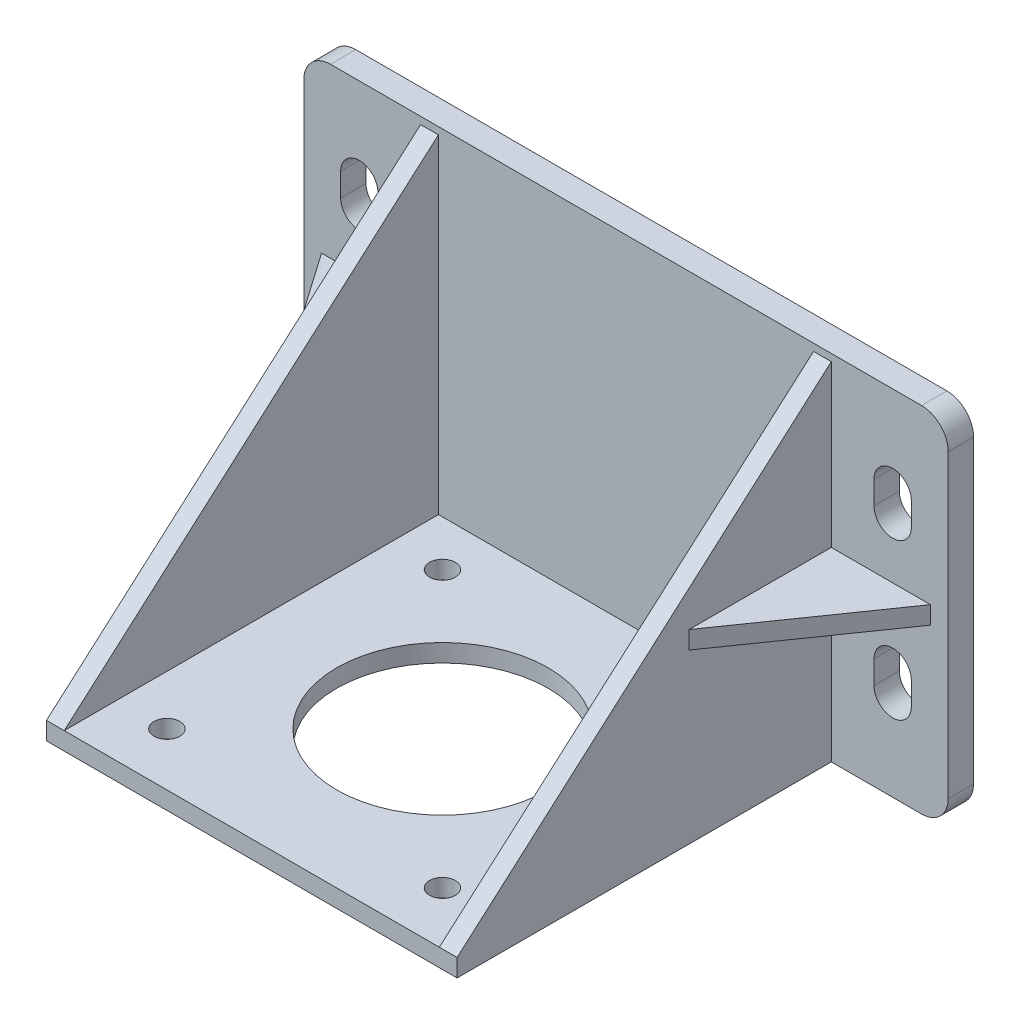
from build123d import *

# Parameters (mm, degrees)
SKETCH1_W           = 72.5
SKETCH1_H           = 39.8
BOSS_EXTRUDE1_DEPTH = 2.85
BOSS_EXTRUDE2_DEPTH = 23.1
SKETCH5_W           = 42.2
SKETCH5_H           = 42.1
CUT_EXTRUDE1_DEPTH  = 37.8
CUT_EXTRUDE2_REACH  = 71.017
SKETCH6_R           = 1.45
SKETCH6_R_2         = 11.9
FILLET1_R           = 3
BOSS_EXTRUDE3_DEPTH = 1


with BuildPart() as part:
    # Sketch1 → Boss-Extrude1 (new body)
    with BuildSketch(Plane.XY):
        Rectangle(SKETCH1_W, SKETCH1_H)
        with BuildLine():
            Line((-27.9, 10.05), (-27.9, 7.45))
            ThreePointArc((-27.9, 7.45), (-30, 5.35), (-32.1, 7.45))
            Line((-32.1, 7.45), (-32.1, 10.05))
            ThreePointArc((-32.1, 10.05), (-30, 12.15), (-27.9, 10.05))
        make_face(mode=Mode.SUBTRACT)
        with BuildLine():
            Line((-27.9, -10.05), (-27.9, -7.45))
            ThreePointArc((-27.9, -7.45), (-30, -5.35), (-32.1, -7.45))
            Line((-32.1, -7.45), (-32.1, -10.05))
            ThreePointArc((-32.1, -10.05), (-30, -12.15), (-27.9, -10.05))
        make_face(mode=Mode.SUBTRACT)
        with BuildLine():
            Line((27.9, 10.05), (27.9, 7.45))
            ThreePointArc((27.9, 7.45), (30, 5.35), (32.1, 7.45))
            Line((32.1, 7.45), (32.1, 10.05))
            ThreePointArc((32.1, 10.05), (30, 12.15), (27.9, 10.05))
        make_face(mode=Mode.SUBTRACT)
        with BuildLine():
            Line((27.9, -10.05), (27.9, -7.45))
            ThreePointArc((27.9, -7.45), (30, -5.35), (32.1, -7.45))
            Line((32.1, -7.45), (32.1, -10.05))
            ThreePointArc((32.1, -10.05), (30, -12.15), (27.9, -10.05))
        make_face(mode=Mode.SUBTRACT)
    extrude(amount=BOSS_EXTRUDE1_DEPTH)

    # Sketch4 → Boss-Extrude2 (add, symmetric)
    with BuildSketch(Plane(origin=(0, 0, 0), x_dir=(0, 0, -1), z_dir=(1, 0, 0))):
        Polygon((-2.85, 19.1), (-44.95, -17.9), (-44.95, -19.9), (-2.85, -19.9), align=None)
    extrude(amount=BOSS_EXTRUDE2_DEPTH, both=True)

    # Sketch5 → Cut-Extrude1 (cut)
    with BuildSketch(Plane(origin=(0, 19.9, 0), x_dir=(1, 0, 0), z_dir=(0, 1, 0))):
        with Locations((0, -23.9)):
            Rectangle(SKETCH5_W, SKETCH5_H)
    extrude(amount=-CUT_EXTRUDE1_DEPTH, mode=Mode.SUBTRACT)

    # Sketch6 → Cut-Extrude2 (cut, up to next)
    with BuildSketch(Plane(origin=(0, -17.9, 0), x_dir=(1, 0, 0), z_dir=(0, 1, 0)), mode=Mode.PRIVATE) as cut_extrude2_sk1:
        with Locations(Location((-15.5, -8, 0), (0, 0, 270))):
            Circle(SKETCH6_R)
    cut_extrude2_tool1 = extrude(cut_extrude2_sk1.sketch, amount=-CUT_EXTRUDE2_REACH, mode=Mode.PRIVATE) & part.part
    # Sketch6 → Cut-Extrude2 (cut, up to next)
    with BuildSketch(Plane(origin=(0, -17.9, 0), x_dir=(1, 0, 0), z_dir=(0, 1, 0)), mode=Mode.PRIVATE) as cut_extrude2_sk2:
        with Locations(Location((15.5, -8, 0), (0, 0, 270))):
            Circle(SKETCH6_R)
    cut_extrude2_tool2 = extrude(cut_extrude2_sk2.sketch, amount=-CUT_EXTRUDE2_REACH, mode=Mode.PRIVATE) & part.part
    # Sketch6 → Cut-Extrude2 (cut, up to next)
    with BuildSketch(Plane(origin=(0, -17.9, 0), x_dir=(1, 0, 0), z_dir=(0, 1, 0)), mode=Mode.PRIVATE) as cut_extrude2_sk3:
        with Locations(Location((15.5, -39, 0), (0, 0, 270))):
            Circle(SKETCH6_R)
    cut_extrude2_tool3 = extrude(cut_extrude2_sk3.sketch, amount=-CUT_EXTRUDE2_REACH, mode=Mode.PRIVATE) & part.part
    # Sketch6 → Cut-Extrude2 (cut, up to next)
    with BuildSketch(Plane(origin=(0, -17.9, 0), x_dir=(1, 0, 0), z_dir=(0, 1, 0)), mode=Mode.PRIVATE) as cut_extrude2_sk4:
        with Locations(Location((-15.5, -39, 0), (0, 0, 270))):
            Circle(SKETCH6_R)
    cut_extrude2_tool4 = extrude(cut_extrude2_sk4.sketch, amount=-CUT_EXTRUDE2_REACH, mode=Mode.PRIVATE) & part.part
    # Sketch6 → Cut-Extrude2 (cut, up to next)
    with BuildSketch(Plane(origin=(0, -17.9, 0), x_dir=(1, 0, 0), z_dir=(0, 1, 0)), mode=Mode.PRIVATE) as cut_extrude2_sk5:
        with Locations(Location((0, -23.5, 0), (0, 0, 270))):
            Circle(SKETCH6_R_2)
    cut_extrude2_tool5 = extrude(cut_extrude2_sk5.sketch, amount=-CUT_EXTRUDE2_REACH, mode=Mode.PRIVATE) & part.part
    add(cut_extrude2_tool1.solids().sort_by_distance((-15.5, -17.9, 8))[0], mode=Mode.SUBTRACT)
    add(cut_extrude2_tool2.solids().sort_by_distance((15.5, -17.9, 8))[0], mode=Mode.SUBTRACT)
    add(cut_extrude2_tool3.solids().sort_by_distance((15.5, -17.9, 39))[0], mode=Mode.SUBTRACT)
    add(cut_extrude2_tool4.solids().sort_by_distance((-15.5, -17.9, 39))[0], mode=Mode.SUBTRACT)
    add(cut_extrude2_tool5.solids().sort_by_distance((0, -17.9, 23.5))[0], mode=Mode.SUBTRACT)

    # Fillet1
    fillet1_edges = [part.edges().sort_by_distance(p)[0] for p in [
        (-36.25, 19.9, 1.425),
        (36.25, 19.9, 1.425),
        (36.25, -19.9, 1.425),
        (-36.25, -19.9, 1.425),
    ]]
    fillet(fillet1_edges, radius=FILLET1_R)

    # Sketch7 → Boss-Extrude3 (add, symmetric)
    with BuildSketch(Plane(origin=(0, 0, 0), x_dir=(1, 0, 0), z_dir=(0, 1, 0))):
        Polygon((34.25, -2.85), (23.1, -18.85), (23.1, -2.85), align=None)
        Polygon((-23.1, -2.85), (-34.25, -2.85), (-23.1, -18.85), align=None)
    extrude(amount=BOSS_EXTRUDE3_DEPTH, both=True)


solid = part.part
